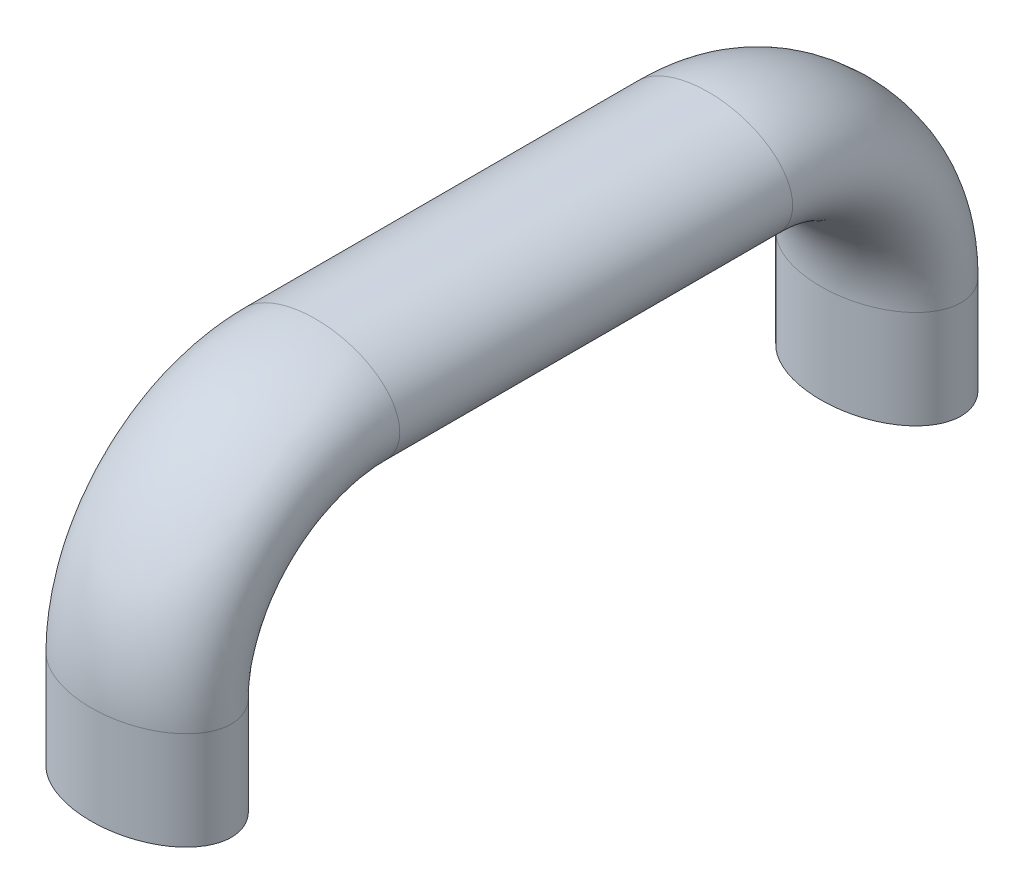
from build123d import *

# Parameters (mm, degrees)
CROQUIS1_RX = 15
CROQUIS1_RY = 10


with BuildPart() as part:
    # Barrer1: sweep along a path in Croquis2
    with BuildLine(Plane(origin=(0, 0, 0), x_dir=(0, 0, -1), z_dir=(1, 0, 0))) as barrer1_path:
        Line((0, 0), (0, 17.5))
        ThreePointArc((0, 17.5), (8.786796564, 38.713203436), (30, 47.5))
        Line((30, 47.5), (100, 47.5))
        ThreePointArc((100, 47.5), (121.213203436, 38.713203436), (130, 17.5))
        Line((130, 17.5), (130, 0))
    # Croquis1 → Barrer1 (sweep)
    with BuildSketch(Plane(origin=(0, 0, 0), x_dir=(1, 0, 0), z_dir=(0, 1, 0))):
        with Locations((0, 0)):
            Ellipse(CROQUIS1_RX, CROQUIS1_RY)
    sweep(path=barrer1_path.line)


solid = part.part
